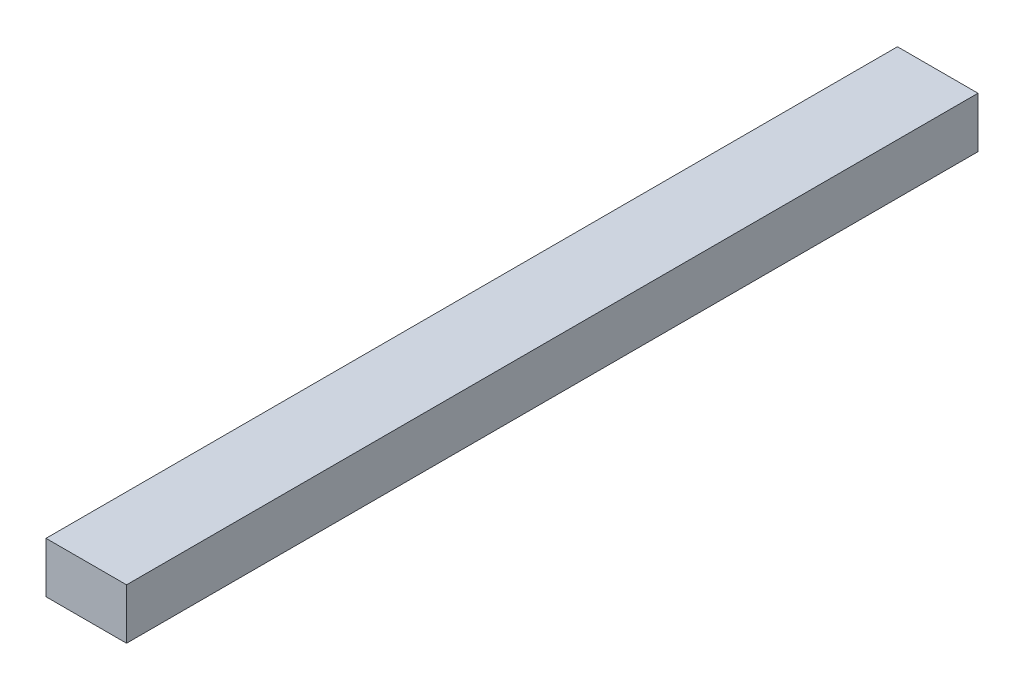
from build123d import *

# Parameters (mm, degrees)
BOSS_EXTRUDE1_DEPTH      = 590
BOSS_EXTRUDE1_DEPTH_BACK = 150
SKETCH1_W                = 70
SKETCH1_H                = 44


with BuildPart() as part:
    # Sketch1 → Boss-Extrude1 (new, two sides: drawn at the far end of the back side and taken through both)
    with BuildSketch(Plane.XY.offset(-BOSS_EXTRUDE1_DEPTH_BACK)):
        Rectangle(SKETCH1_W, SKETCH1_H)
    extrude(amount=BOSS_EXTRUDE1_DEPTH + BOSS_EXTRUDE1_DEPTH_BACK)


solid = part.part
